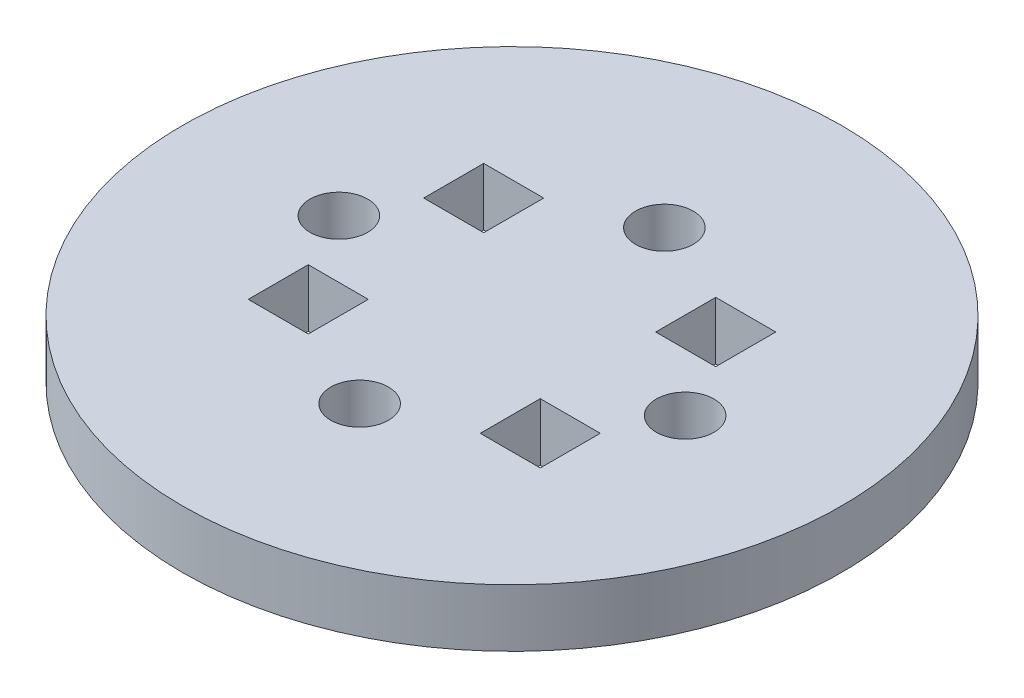
from build123d import *

# Parameters (mm, degrees)
SKETCH1_R           = 36.2585
SKETCH1_R_2         = 3.175
BOSS_EXTRUDE1_DEPTH = 6.35
SKETCH2_W           = 6.604
SKETCH2_H           = 6.604
CUT_EXTRUDE1_DEPTH  = 10.16


with BuildPart() as part:
    # Sketch1 → Boss-Extrude1 (new body)
    with BuildSketch(Plane(origin=(0, 0, 0), x_dir=(1, 0, 0), z_dir=(0, 1, 0))):
        with Locations(Location((0, 0, 0), (0, 0, 270))):
            Circle(SKETCH1_R)
        with Locations(Location((0, 16.764, 0), (0, 0, 270))):
            Circle(SKETCH1_R_2, mode=Mode.SUBTRACT)
        with Locations(Location((0, -16.764, 0), (0, 0, 270))):
            Circle(SKETCH1_R_2, mode=Mode.SUBTRACT)
        with Locations(Location((-19.05, 0, 0), (0, 0, 270))):
            Circle(SKETCH1_R_2, mode=Mode.SUBTRACT)
        with Locations(Location((19.05, 0, 0), (0, 0, 270))):
            Circle(SKETCH1_R_2, mode=Mode.SUBTRACT)
    extrude(amount=BOSS_EXTRUDE1_DEPTH)

    # Sketch2 → Cut-Extrude1 (cut)
    with BuildSketch(Plane(origin=(0, 6.35, 0), x_dir=(1, 0, 0), z_dir=(0, 1, 0))):
        with Locations((-12.7635, 9.652)):
            Rectangle(SKETCH2_W, SKETCH2_H)
        with Locations((-12.7635, -9.652)):
            Rectangle(SKETCH2_W, SKETCH2_H)
        with Locations((12.7635, 9.652)):
            Rectangle(SKETCH2_W, SKETCH2_H)
        with Locations((12.7635, -9.652)):
            Rectangle(SKETCH2_W, SKETCH2_H)
    extrude(amount=-CUT_EXTRUDE1_DEPTH, mode=Mode.SUBTRACT)


solid = part.part
